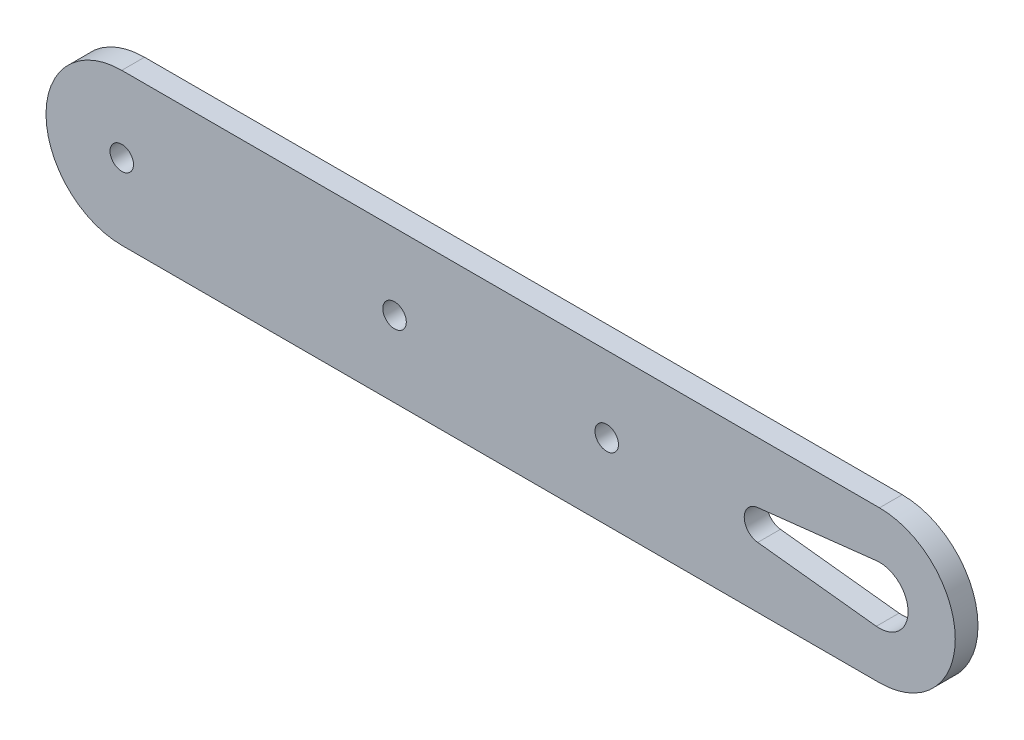
from build123d import *

# Parameters (mm, degrees)
BOSS_EXTRUDE1_DEPTH = 3
CUT_EXTRUDE1_DEPTH  = 3
SKETCH3_R           = 1.55
CUT_EXTRUDE2_DEPTH  = 3
SKETCH4_R           = 1.55
CUT_EXTRUDE4_DEPTH  = 3
SKETCH5_R           = 1.55
CUT_EXTRUDE6_DEPTH  = 3


with BuildPart() as part:
    # Sketch1 → Boss-Extrude1 (new body)
    with BuildSketch(Plane.XY):
        with BuildLine():
            Line((-58.058617241, 24.191090517), (41.941382759, 24.191090517))
            ThreePointArc((41.941382759, 24.191090517), (51.941382759, 14.191090517), (41.941382759, 4.191090517))
            Line((41.941382759, 4.191090517), (-58.058617241, 4.191090517))
            ThreePointArc((-58.058617241, 4.191090517), (-68.058617241, 14.191090517), (-58.058617241, 24.191090517))
        make_face()
    extrude(amount=BOSS_EXTRUDE1_DEPTH)

    # Sketch2 → Cut-Extrude1 (cut)
    with BuildSketch(Plane.XY.offset(3)):
        with BuildLine():
            Line((41.520256561, 17.941090517), (25.870256561, 16.183590517))
            ThreePointArc((25.870256561, 16.183590517), (24.088990243, 14.191090517), (25.870256561, 12.198590517))
            Line((25.870256561, 12.198590517), (41.520256561, 10.441090517))
            ThreePointArc((41.520256561, 10.441090517), (45.714954976, 14.191090517), (41.520256561, 17.941090517))
        make_face()
    extrude(amount=-CUT_EXTRUDE1_DEPTH, mode=Mode.SUBTRACT)

    # Sketch3 → Cut-Extrude2 (cut)
    with BuildSketch(Plane.XY.offset(3)):
        with Locations((-58.058617241, 14.191090517)):
            Circle(SKETCH3_R)
    extrude(amount=-CUT_EXTRUDE2_DEPTH, mode=Mode.SUBTRACT)

    # Sketch4 → Cut-Extrude4 (cut)
    with BuildSketch(Plane(origin=(9.979459273, 1.433252018, 3), x_dir=(1, 0, 0), z_dir=(0, 0, 1))):
        with Locations((-4.038076514, 12.757838499)):
            Circle(SKETCH4_R)
    extrude(amount=-CUT_EXTRUDE4_DEPTH, mode=Mode.SUBTRACT)

    # Sketch5 → Cut-Extrude6 (cut)
    with BuildSketch(Plane(origin=(-9.979459273, 1.433252018, 0), x_dir=(-1, 0, 0), z_dir=(0, 0, -1))):
        with Locations((12.079157968, 12.757838499)):
            Circle(SKETCH5_R)
    extrude(amount=-CUT_EXTRUDE6_DEPTH, mode=Mode.SUBTRACT)


solid = part.part
